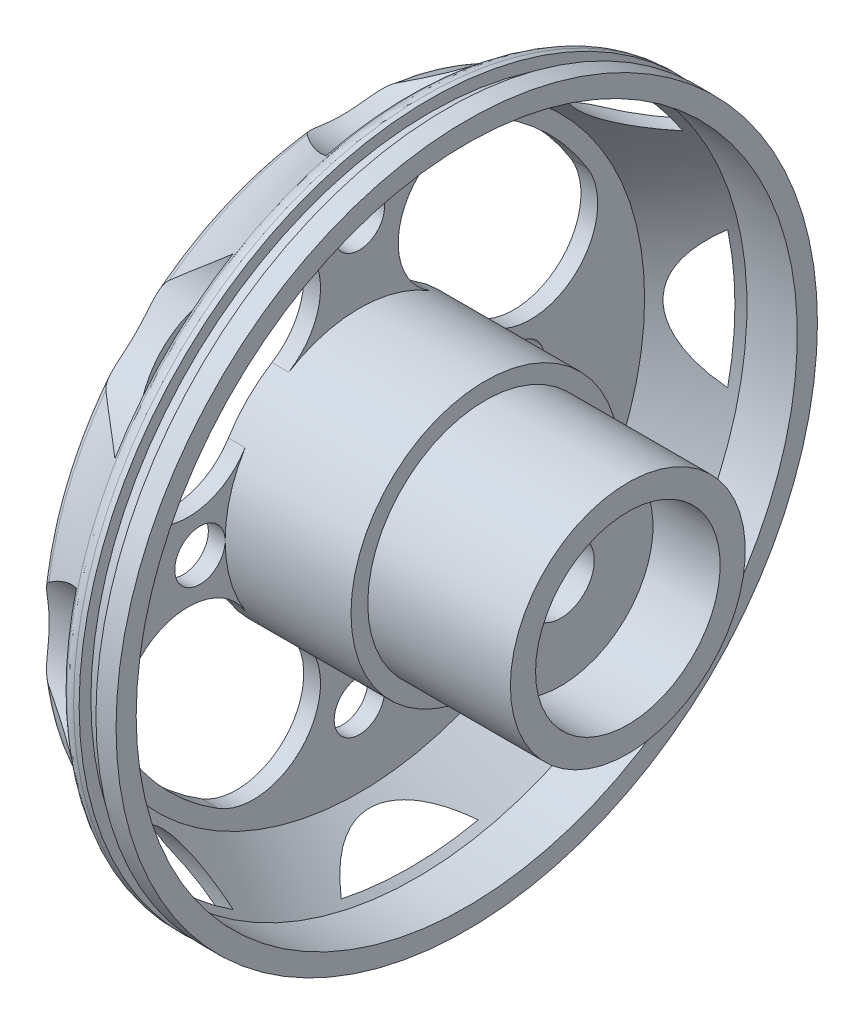
from build123d import *
from build123d.topology import SkipClean

# Parameters (mm, degrees)
REDONDEO1_R           = 1
CORTAR_EXTRUIR1_START = -4
CORTAR_EXTRUIR1_DEPTH = 4
CROQUIS3_R            = 1.5
CORTAR_EXTRUIR2_DEPTH = 35.097214085


with BuildPart() as part:
    # Croquis1 → Revolución1 (revolve)
    with BuildSketch(Plane.XY, mode=Mode.PRIVATE) as revoluci_n1_sk:
        with BuildLine():
            Line((17, 5.5), (13, 5.5))
            Line((13, 5.5), (13, 2))
            Line((13, 2), (4, 2))
            Line((4, 2), (4, 5.5))
            Line((4, 5.5), (0, 5.5))
            Line((0, 5.5), (0, 18))
            ThreePointArc((0, 18), (2.356974098, 19.28400571), (4.5, 20.9))
            Line((4.5, 20.9), (5.2, 20.9))
            Line((5.2, 20.9), (5.2, 20.2))
            Line((5.2, 20.2), (6.2, 20.2))
            Line((6.2, 20.2), (6.2, 20.9))
            Line((6.2, 20.9), (7.4, 20.9))
            Line((7.4, 20.9), (7.4, 19.7))
            Line((7.4, 19.7), (4.4, 19.7))
            Line((4.4, 19.7), (1, 17))
            Line((1, 17), (1, 8))
            Line((1, 8), (8.5, 8))
            Line((8.5, 8), (8.5, 7))
            Line((8.5, 7), (17, 7))
            Line((17, 7), (17, 5.5))
        make_face()
    revolve(revoluci_n1_sk.sketch.rotate(Axis((0, 0, 0), (1, 0, 0)), 90), axis=Axis((0, 0, 0), (1, 0, 0)))

    # Redondeo1
    redondeo1_edges = [part.edges().sort_by_distance(p)[0] for p in [
        (0, 0, -18),
        (4.5, 0, -20.9),
    ]]
    fillet(redondeo1_edges, radius=REDONDEO1_R)

    # Croquis2 → Cortar-Extruir1 (cut)
    with SkipClean():  # the faces are left unmerged after this step: merging them gives an invalid solid
        with BuildSketch(Plane.ZY.offset(CORTAR_EXTRUIR1_START)):
            with BuildLine():
                ThreePointArc((13.605343889, 8.41989416), (11.313708499, 11.313708499), (8.41989416, 13.605343889))
                ThreePointArc((8.41989416, 13.605343889), (2.913584648, 12.308981457), (4.20994708, 6.802671944))
                ThreePointArc((4.20994708, 6.802671944), (5.656854249, 5.656854249), (6.802671944, 4.20994708))
                ThreePointArc((6.802671944, 4.20994708), (12.308981457, 2.913584648), (13.605343889, 8.41989416))
            make_face()
            with BuildLine():
                ThreePointArc((8.41989416, -13.605343889), (11.313708499, -11.313708499), (13.605343889, -8.41989416))
                ThreePointArc((13.605343889, -8.41989416), (12.308981457, -2.913584648), (6.802671944, -4.20994708))
                ThreePointArc((6.802671944, -4.20994708), (5.656854249, -5.656854249), (4.20994708, -6.802671944))
                ThreePointArc((4.20994708, -6.802671944), (2.913584648, -12.308981457), (8.41989416, -13.605343889))
            make_face()
            with BuildLine():
                ThreePointArc((-13.605343889, -8.41989416), (-11.313708499, -11.313708499), (-8.41989416, -13.605343889))
                ThreePointArc((-8.41989416, -13.605343889), (-2.913584648, -12.308981457), (-4.20994708, -6.802671944))
                ThreePointArc((-4.20994708, -6.802671944), (-5.656854249, -5.656854249), (-6.802671944, -4.20994708))
                ThreePointArc((-6.802671944, -4.20994708), (-12.308981457, -2.913584648), (-13.605343889, -8.41989416))
            make_face()
            with BuildLine():
                ThreePointArc((-8.41989416, 13.605343889), (-11.313708499, 11.313708499), (-13.605343889, 8.41989416))
                ThreePointArc((-13.605343889, 8.41989416), (-12.308981457, 2.913584648), (-6.802671944, 4.20994708))
                ThreePointArc((-6.802671944, 4.20994708), (-5.656854249, 5.656854249), (-4.20994708, 6.802671944))
                ThreePointArc((-4.20994708, 6.802671944), (-2.913584648, 12.308981457), (-8.41989416, 13.605343889))
            make_face()
            with BuildLine():
                ThreePointArc((10.58178547, 18.023202165), (12.363472684, 12.363472684), (18.023202165, 10.58178547))
                ThreePointArc((18.023202165, 10.58178547), (14.778531727, 14.778531727), (10.58178547, 18.023202165))
            make_face()
            with BuildLine():
                ThreePointArc((20.226780732, 5.261876207), (17.484590748, 0), (20.226780732, -5.261876207))
                ThreePointArc((20.226780732, -5.261876207), (20.9, 0), (20.226780732, 5.261876207))
            make_face()
            with BuildLine():
                ThreePointArc((18.023202165, -10.58178547), (12.363472684, -12.363472684), (10.58178547, -18.023202165))
                ThreePointArc((10.58178547, -18.023202165), (14.778531727, -14.778531727), (18.023202165, -10.58178547))
            make_face()
            with BuildLine():
                ThreePointArc((5.261876207, -20.226780732), (0, -17.484590748), (-5.261876207, -20.226780732))
                ThreePointArc((-5.261876207, -20.226780732), (0, -20.9), (5.261876207, -20.226780732))
            make_face()
            with BuildLine():
                ThreePointArc((-10.58178547, -18.023202165), (-12.363472684, -12.363472684), (-18.023202165, -10.58178547))
                ThreePointArc((-18.023202165, -10.58178547), (-14.778531727, -14.778531727), (-10.58178547, -18.023202165))
            make_face()
            with BuildLine():
                ThreePointArc((-20.226780732, -5.261876207), (-17.484590748, 0), (-20.226780732, 5.261876207))
                ThreePointArc((-20.226780732, 5.261876207), (-20.9, 0), (-20.226780732, -5.261876207))
            make_face()
            with BuildLine():
                ThreePointArc((-18.023202165, 10.58178547), (-12.363472684, 12.363472684), (-10.58178547, 18.023202165))
                ThreePointArc((-10.58178547, 18.023202165), (-14.778531727, 14.778531727), (-18.023202165, 10.58178547))
            make_face()
            with BuildLine():
                ThreePointArc((-5.261876207, 20.226780732), (0, 17.484590748), (5.261876207, 20.226780732))
                ThreePointArc((5.261876207, 20.226780732), (0, 20.9), (-5.261876207, 20.226780732))
            make_face()
        extrude(amount=CORTAR_EXTRUIR1_DEPTH, mode=Mode.SUBTRACT)

    # Croquis3 → Cortar-Extruir2 (cut, through all)
    with SkipClean():  # the faces are left unmerged after this step: merging them gives an invalid solid
        with BuildSketch(Plane.ZY):
            with Locations((0, 12.5)):
                Circle(CROQUIS3_R)
            with Locations((0, -12.5)):
                Circle(CROQUIS3_R)
            with Locations((9.5, 0)):
                Circle(CROQUIS3_R)
            with Locations((-9.5, 0)):
                Circle(CROQUIS3_R)
        extrude(amount=-CORTAR_EXTRUIR2_DEPTH, mode=Mode.SUBTRACT)


solid = part.part
